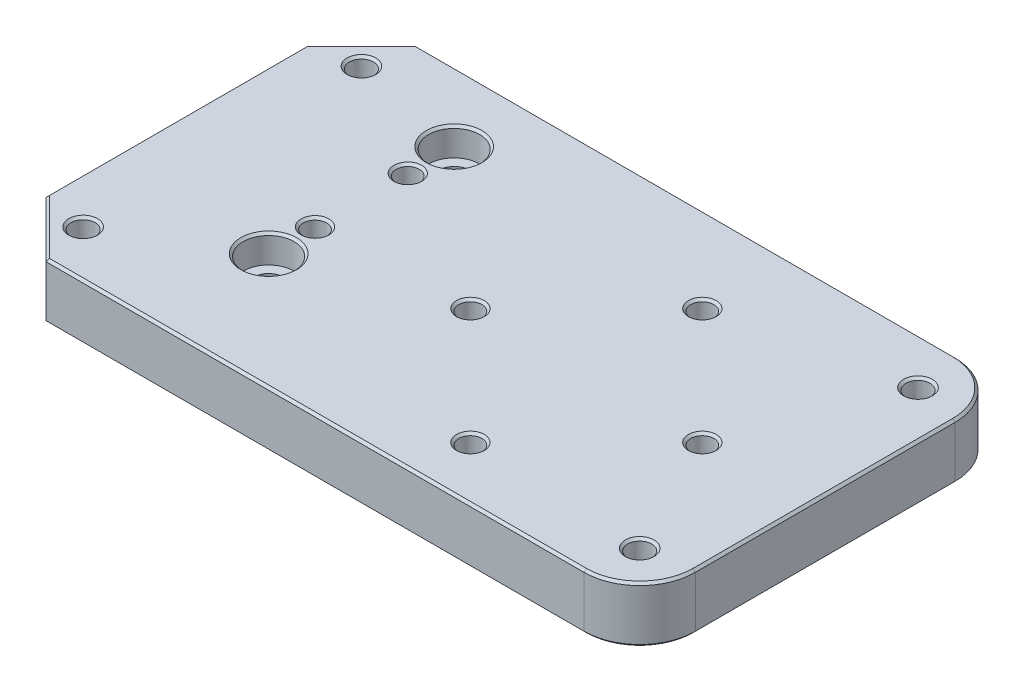
from build123d import *

# Parameters (mm, degrees)
SKETCH1_R                       = 2.6
SKETCH1_R_2                     = 2.5
BOSS_EXTRUDE1_DEPTH             = 6
SKETCH1_3_R                     = 5.5
CUT_EXTRUDE1_DEPTH              = 6
SKETCH2_R                       = 3.25
CUT_EXTRUDE2_DEPTH              = 6
CUT_EXTRUDE3_START              = -4.5
SKETCH1_4_R                     = 5.5
CUT_EXTRUDE3_DEPTH              = 4.5
F_6_0_2361_DIAMETER_HOLE1_D     = 5.99694
F_6_0_2361_DIAMETER_HOLE1_DEPTH = 2.69833746
F_6_0_2361_DIAMETER_HOLE1_TIP   = 1.80166254
F_6_0_2361_DIAMETER_HOLE4_D     = 5.99694
F_6_0_2361_DIAMETER_HOLE4_DEPTH = 4.19833746
F_6_0_2361_DIAMETER_HOLE4_TIP   = 1.80166254
SKETCH9_R                       = 4
CUT_EXTRUDE4_DEPTH              = 15
F_6_0_2361_DIAMETER_HOLE3_D     = 5.99694
F_6_0_2361_DIAMETER_HOLE3_DEPTH = 73
F_6_0_2361_DIAMETER_HOLE3_TIP   = 1.80166254
CHAMFER1_SIZE                   = 0.5
CHAMFER2_SIZE                   = 0.5


with BuildPart() as part:
    # Sketch1 → Boss-Extrude1 (new, symmetric)
    with BuildSketch(Plane(origin=(0, 0, 0), x_dir=(1, 0, 0), z_dir=(0, 1, 0))):
        with BuildLine():
            Line((58, 40), (-58, 40))
            Line((-58, 40), (-70, 28))
            Line((-70, 28), (-70, -28))
            Line((-70, -28), (-58, -40))
            Line((-58, -40), (58, -40))
            ThreePointArc((58, -40), (66.485281374, -36.485281374), (70, -28))
            Line((70, -28), (70, 28))
            ThreePointArc((70, 28), (66.485281374, 36.485281374), (58, 40))
        make_face()
        with Locations((-60, -30)):
            Circle(SKETCH1_R, mode=Mode.SUBTRACT)
        with Locations((-35, -5)):
            Circle(SKETCH1_R_2, mode=Mode.SUBTRACT)
        with Locations((-3, -3.5)):
            Circle(SKETCH1_R_2, mode=Mode.SUBTRACT)
        with Locations((22, -28.5)):
            Circle(SKETCH1_R_2, mode=Mode.SUBTRACT)
        with Locations((60, -30)):
            Circle(SKETCH1_R, mode=Mode.SUBTRACT)
        with Locations((47, -3.5)):
            Circle(SKETCH1_R_2, mode=Mode.SUBTRACT)
        with Locations((-35, 15)):
            Circle(SKETCH1_R_2, mode=Mode.SUBTRACT)
        with Locations((-60, 30)):
            Circle(SKETCH1_R, mode=Mode.SUBTRACT)
        with Locations((22, 21.5)):
            Circle(SKETCH1_R_2, mode=Mode.SUBTRACT)
        with Locations((60, 30)):
            Circle(SKETCH1_R, mode=Mode.SUBTRACT)
    extrude(amount=BOSS_EXTRUDE1_DEPTH, both=True)

    # Sketch1<3> → Cut-Extrude1 (cut)
    with BuildSketch(Plane(origin=(0, 0, 0), x_dir=(1, 0, 0), z_dir=(0, 1, 0))):
        with Locations((-35, 25)):
            Circle(SKETCH1_3_R)
        with Locations((-35, -15)):
            Circle(SKETCH1_3_R)
    extrude(amount=CUT_EXTRUDE1_DEPTH, mode=Mode.SUBTRACT)

    # Sketch2 → Cut-Extrude2 (cut)
    with BuildSketch(Plane(origin=(0, 0, 0), x_dir=(1, 0, 0), z_dir=(0, 1, 0))):
        with Locations((-35, 25)):
            Circle(SKETCH2_R)
        with Locations((-35, -15)):
            Circle(SKETCH2_R)
    extrude(amount=-CUT_EXTRUDE2_DEPTH, mode=Mode.SUBTRACT)

    # Sketch1<4> → Cut-Extrude3 (cut)
    with BuildSketch(Plane(origin=(0, 0, 0), x_dir=(1, 0, 0), z_dir=(0, 1, 0)).offset(CUT_EXTRUDE3_START)):
        with Locations((-35, 5)):
            Circle(SKETCH1_4_R)
    extrude(amount=-CUT_EXTRUDE3_DEPTH, mode=Mode.SUBTRACT)

    # #6 (0.2361) Diameter Hole1
    with Locations(Plane(origin=(0, -4.5, 0), x_dir=(-1, 0, 0), z_dir=(0, -1, 0))):
        with Locations((35, 5)):
            Hole(F_6_0_2361_DIAMETER_HOLE1_D / 2, depth=F_6_0_2361_DIAMETER_HOLE1_DEPTH)
            with Locations((0, 0, -(F_6_0_2361_DIAMETER_HOLE1_DEPTH + F_6_0_2361_DIAMETER_HOLE1_TIP / 2))):  # 118° drill point
                Cone(0, F_6_0_2361_DIAMETER_HOLE1_D / 2, F_6_0_2361_DIAMETER_HOLE1_TIP, mode=Mode.SUBTRACT)

    # #6 (0.2361) Diameter Hole4
    with Locations(Plane(origin=(0, -6, 0), x_dir=(-1, 0, 0), z_dir=(0, -1, 0))):
        with Locations((-14, 5)):
            Hole(F_6_0_2361_DIAMETER_HOLE4_D / 2, depth=F_6_0_2361_DIAMETER_HOLE4_DEPTH)
            with Locations((0, 0, -(F_6_0_2361_DIAMETER_HOLE4_DEPTH + F_6_0_2361_DIAMETER_HOLE4_TIP / 2))):  # 118° drill point
                Cone(0, F_6_0_2361_DIAMETER_HOLE4_D / 2, F_6_0_2361_DIAMETER_HOLE4_TIP, mode=Mode.SUBTRACT)

    # Sketch9 → Cut-Extrude4 (cut)
    with BuildSketch(Plane.ZY.offset(70)):
        with Locations((-5, 0)):
            Circle(SKETCH9_R)
    extrude(amount=-CUT_EXTRUDE4_DEPTH, mode=Mode.SUBTRACT)

    # #6 (0.2361) Diameter Hole3
    with Locations(Plane.ZY.offset(55)):
        with Locations((-5, 0)):
            Hole(F_6_0_2361_DIAMETER_HOLE3_D / 2, depth=F_6_0_2361_DIAMETER_HOLE3_DEPTH)
            with Locations((0, 0, -(F_6_0_2361_DIAMETER_HOLE3_DEPTH + F_6_0_2361_DIAMETER_HOLE3_TIP / 2))):  # 118° drill point
                Cone(0, F_6_0_2361_DIAMETER_HOLE3_D / 2, F_6_0_2361_DIAMETER_HOLE3_TIP, mode=Mode.SUBTRACT)

    # Chamfer1
    chamfer1_edges = [part.edges().sort_by_distance(p)[0] for p in [
        (-37.5, 6, 5),
        (-37.5, 6, -15),
        (-62.6, 6, -30),
        (-62.6, 6, 30),
        (70, 6, 0),
        (66.485281374, 6, 36.485281374),
        (0, 6, 40),
        (-64, 6, 34),
        (-70, 6, 0),
        (-64, 6, -34),
        (0, 6, -40),
        (66.485281374, 6, -36.485281374),
        (57.4, 6, -30),
        (57.4, 6, 30),
        (19.5, 6, -21.5),
        (44.5, 6, 3.5),
        (19.5, 6, 28.5),
        (-5.5, 6, 3.5),
        (-40.5, 6, -25),
        (-40.5, 6, 15),
    ]]
    chamfer(chamfer1_edges, length=CHAMFER1_SIZE)

    # Chamfer2
    chamfer2_edges = [part.edges().sort_by_distance(p)[0] for p in [
        (-37.5, -6, 5),
        (-37.5, -6, -15),
        (-62.6, -6, -30),
        (-62.6, -6, 30),
        (0, -6, -40),
        (-64, -6, -34),
        (-70, -6, 0),
        (-64, -6, 34),
        (0, -6, 40),
        (66.485281374, -6, 36.485281374),
        (70, -6, 0),
        (66.485281374, -6, -36.485281374),
        (57.4, -6, -30),
        (57.4, -6, 30),
        (19.5, -6, -21.5),
        (44.5, -6, 3.5),
        (19.5, -6, 28.5),
        (-5.5, -6, 3.5),
        (-38.25, -6, 15),
        (-38.25, -6, -25),
        (-40.5, -6, -5),
        (11.00153, -6, -5),
    ]]
    chamfer(chamfer2_edges, length=CHAMFER2_SIZE)


solid = part.part
